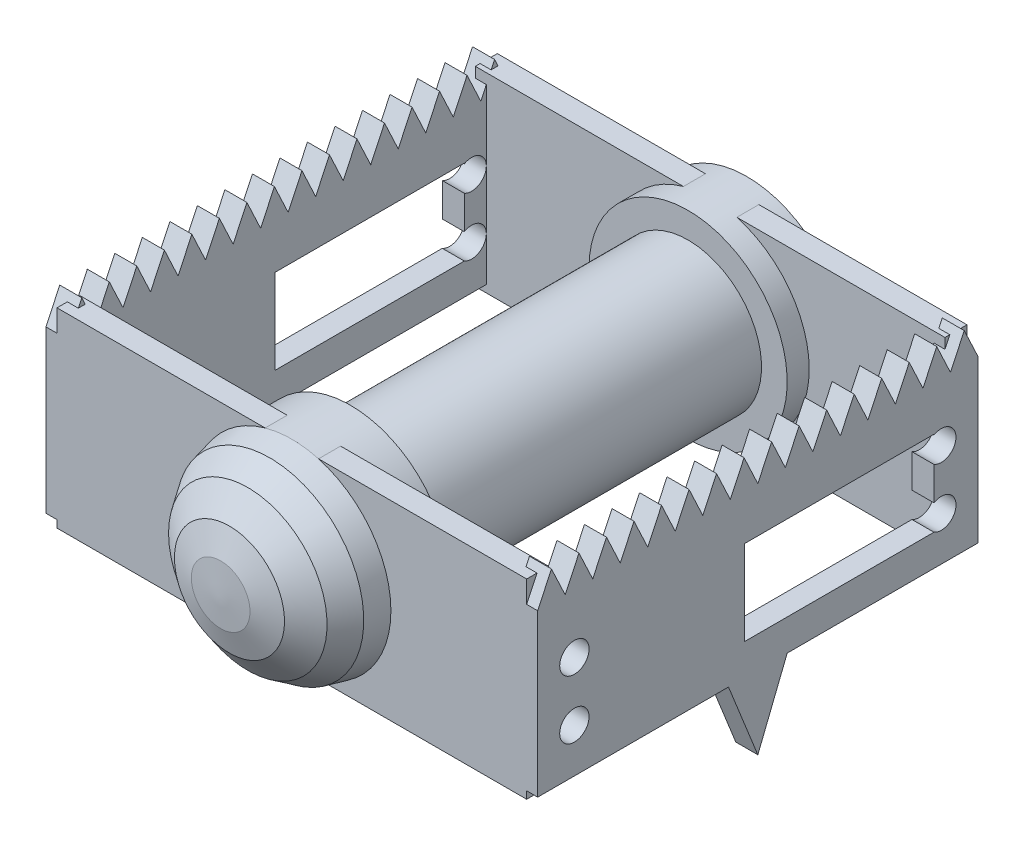
from build123d import *

# Parameters (mm, degrees)
PLACA_DELANTERA_START               = 203
PLACA_DELANTERA_DEPTH               = 3
AGUJERO_PLACA_DELANTERA_1_PROFILE_R = 2
AGUJERO_PLACA_DELANTERA_2_PROFILE_R = 2
AGUJERO_PLACA_DELANTERA_3_PROFILE_R = 2
AGUJERO_PLACA_DELANTERA_4_PROFILE_R = 2
PLACA_TRASERA_START                 = 139
PLACA_TRASERA_DEPTH                 = 3
AGUJERO_PLACA_TRASERA_1_PROFILE_R   = 2
AGUJERO_PLACA_TRASERA_2_PROFILE_R   = 2
AGUJERO_PLACA_TRASERA_3_PROFILE_R   = 2
AGUJERO_PLACA_TRASERA_4_PROFILE_R   = 2
MARCO_INTERIOR_START                = 86
SK_MARCO_INTERIOR_W                 = 64
SK_MARCO_INTERIOR_H                 = 26
SK_MARCO_INTERIOR_R                 = 11
MARCO_INTERIOR_DEPTH                = 3
MARCO_EXTERIOR_START                = 143
SK_MARCO_EXTERIOR_W                 = 64
SK_MARCO_EXTERIOR_H                 = 26
SK_MARCO_EXTERIOR_R                 = 11
MARCO_EXTERIOR_DEPTH                = 3
CROQUIS17_W                         = 25.795648089
CROQUIS17_H                         = 11.561302328
CORTAR_EXTRUIR1_DEPTH               = 10


with BuildPart() as part:
    # Sk_Eje_cuerpo → Eje_cuerpo (revolve)
    with BuildSketch(Plane(origin=(0, 0, 0), x_dir=(1, 0, 0), z_dir=(0, 1, 0))):
        Polygon((183.5, -84), (186, -84), (186, -92), (182.5, -92), (182.5, -138), (186, -138), (186, -146), (185.3, -149), (183.3, -152), (180, -154.5), (176.5, -155.7), (172.5, -156), (172.5, -147), (183.5, -147), (183.5, -138.5), (178.8, -138.5), (178.8, -91.5), (183.5, -91.5), align=None)
    revolve(axis=Axis((172.5, 0, 62.1), (0, 0, 1)))



with BuildPart() as body_2:
    # Sk_Placa_delantera → Placa_delantera (new body)
    with BuildSketch(Plane(origin=(0, 0, 0), x_dir=(0, 0, -1), z_dir=(1, 0, 0)).offset(PLACA_DELANTERA_START)):
        Polygon((-86, -12), (-112, -12), (-116, -22), (-120, -12), (-146, -12), (-146, 10), (-144.125, 14), (-142.25, 10), (-140.375, 14), (-138.5, 10), (-136.625, 14), (-134.75, 10), (-132.875, 14), (-131, 10), (-129.125, 14), (-127.25, 10), (-125.375, 14), (-123.5, 10), (-121.625, 14), (-119.75, 10), (-117.875, 14), (-116, 10), (-114.125, 14), (-112.25, 10), (-110.375, 14), (-108.5, 10), (-106.625, 14), (-104.75, 10), (-102.875, 14), (-101, 10), (-99.125, 14), (-97.25, 10), (-95.375, 14), (-93.5, 10), (-91.625, 14), (-89.75, 10), (-87.875, 14), (-86, 10), align=None)
    extrude(amount=PLACA_DELANTERA_DEPTH)

    # Agujero_Placa_delantera_1: sweep along a curve in space
    with BuildLine() as agujero_placa_delantera_1_path:
        Line((201.5, -6, 91), (207.5, -6, 91))
    # Agujero_Placa_delantera_1 profile (on start of the path) → Agujero_Placa_delantera_1 (sweep, cut)
    with BuildSketch(Plane(origin=(201.5, -6, 91), x_dir=(0, 0, 1), z_dir=(1, 0, 0))):
        Circle(AGUJERO_PLACA_DELANTERA_1_PROFILE_R)
    sweep(path=agujero_placa_delantera_1_path.line, mode=Mode.SUBTRACT)

    # Agujero_Placa_delantera_2: sweep along a curve in space
    with BuildLine() as agujero_placa_delantera_2_path:
        Line((201.5, 2, 91), (207.5, 2, 91))
    # Agujero_Placa_delantera_2 profile (on start of the path) → Agujero_Placa_delantera_2 (sweep, cut)
    with BuildSketch(Plane(origin=(201.5, 2, 91), x_dir=(0, 0, 1), z_dir=(1, 0, 0))):
        Circle(AGUJERO_PLACA_DELANTERA_2_PROFILE_R)
    sweep(path=agujero_placa_delantera_2_path.line, mode=Mode.SUBTRACT)

    # Agujero_Placa_delantera_3: sweep along a curve in space
    with BuildLine() as agujero_placa_delantera_3_path:
        Line((201.5, -6, 141), (207.5, -6, 141))
    # Agujero_Placa_delantera_3 profile (on start of the path) → Agujero_Placa_delantera_3 (sweep, cut)
    with BuildSketch(Plane(origin=(201.5, -6, 141), x_dir=(0, 0, 1), z_dir=(1, 0, 0))):
        Circle(AGUJERO_PLACA_DELANTERA_3_PROFILE_R)
    sweep(path=agujero_placa_delantera_3_path.line, mode=Mode.SUBTRACT)

    # Agujero_Placa_delantera_4: sweep along a curve in space
    with BuildLine() as agujero_placa_delantera_4_path:
        Line((201.5, 2, 141), (207.5, 2, 141))
    # Agujero_Placa_delantera_4 profile (on start of the path) → Agujero_Placa_delantera_4 (sweep, cut)
    with BuildSketch(Plane(origin=(201.5, 2, 141), x_dir=(0, 0, 1), z_dir=(1, 0, 0))):
        Circle(AGUJERO_PLACA_DELANTERA_4_PROFILE_R)
    sweep(path=agujero_placa_delantera_4_path.line, mode=Mode.SUBTRACT)


with BuildPart() as body_3:
    # Sk_Placa_trasera → Placa_trasera (new body)
    with BuildSketch(Plane(origin=(0, 0, 0), x_dir=(0, 0, -1), z_dir=(1, 0, 0)).offset(PLACA_TRASERA_START)):
        Polygon((-86, -12), (-146, -12), (-146, 10), (-144.125, 14), (-142.25, 10), (-140.375, 14), (-138.5, 10), (-136.625, 14), (-134.75, 10), (-132.875, 14), (-131, 10), (-129.125, 14), (-127.25, 10), (-125.375, 14), (-123.5, 10), (-121.625, 14), (-119.75, 10), (-117.875, 14), (-116, 10), (-114.125, 14), (-112.25, 10), (-110.375, 14), (-108.5, 10), (-106.625, 14), (-104.75, 10), (-102.875, 14), (-101, 10), (-99.125, 14), (-97.25, 10), (-95.375, 14), (-93.5, 10), (-91.625, 14), (-89.75, 10), (-87.875, 14), (-86, 10), align=None)
    extrude(amount=PLACA_TRASERA_DEPTH)

    # Agujero_Placa_trasera_1: sweep along a curve in space
    with BuildLine() as agujero_placa_trasera_1_path:
        Line((137.5, -6, 91), (143.5, -6, 91))
    # Agujero_Placa_trasera_1 profile (on start of the path) → Agujero_Placa_trasera_1 (sweep, cut)
    with BuildSketch(Plane(origin=(137.5, -6, 91), x_dir=(0, 0, 1), z_dir=(1, 0, 0))):
        Circle(AGUJERO_PLACA_TRASERA_1_PROFILE_R)
    sweep(path=agujero_placa_trasera_1_path.line, mode=Mode.SUBTRACT)

    # Agujero_Placa_trasera_2: sweep along a curve in space
    with BuildLine() as agujero_placa_trasera_2_path:
        Line((137.5, 2, 91), (143.5, 2, 91))
    # Agujero_Placa_trasera_2 profile (on start of the path) → Agujero_Placa_trasera_2 (sweep, cut)
    with BuildSketch(Plane(origin=(137.5, 2, 91), x_dir=(0, 0, 1), z_dir=(1, 0, 0))):
        Circle(AGUJERO_PLACA_TRASERA_2_PROFILE_R)
    sweep(path=agujero_placa_trasera_2_path.line, mode=Mode.SUBTRACT)

    # Agujero_Placa_trasera_3: sweep along a curve in space
    with BuildLine() as agujero_placa_trasera_3_path:
        Line((137.5, -6, 141), (143.5, -6, 141))
    # Agujero_Placa_trasera_3 profile (on start of the path) → Agujero_Placa_trasera_3 (sweep, cut)
    with BuildSketch(Plane(origin=(137.5, -6, 141), x_dir=(0, 0, 1), z_dir=(1, 0, 0))):
        Circle(AGUJERO_PLACA_TRASERA_3_PROFILE_R)
    sweep(path=agujero_placa_trasera_3_path.line, mode=Mode.SUBTRACT)

    # Agujero_Placa_trasera_4: sweep along a curve in space
    with BuildLine() as agujero_placa_trasera_4_path:
        Line((137.5, 2, 141), (143.5, 2, 141))
    # Agujero_Placa_trasera_4 profile (on start of the path) → Agujero_Placa_trasera_4 (sweep, cut)
    with BuildSketch(Plane(origin=(137.5, 2, 141), x_dir=(0, 0, 1), z_dir=(1, 0, 0))):
        Circle(AGUJERO_PLACA_TRASERA_4_PROFILE_R)
    sweep(path=agujero_placa_trasera_4_path.line, mode=Mode.SUBTRACT)


with BuildPart() as part_1:
    add(part.part)

    add(body_2.part)  # Marco_interior merges body 2

    add(body_3.part)  # Marco_interior merges body 3
    # Sk_Marco_interior → Marco_interior (add)
    with BuildSketch(Plane.XY.offset(MARCO_INTERIOR_START)):
        with Locations((172.5, 0)):
            Rectangle(SK_MARCO_INTERIOR_W, SK_MARCO_INTERIOR_H)
        with Locations((172.5, 0)):
            Circle(SK_MARCO_INTERIOR_R, mode=Mode.SUBTRACT)
    extrude(amount=MARCO_INTERIOR_DEPTH)

    # Sk_Marco_exterior → Marco_exterior (add)
    with BuildSketch(Plane.XY.offset(MARCO_EXTERIOR_START)):
        with Locations((172.5, 0)):
            Rectangle(SK_MARCO_EXTERIOR_W, SK_MARCO_EXTERIOR_H)
        with Locations((172.5, 0)):
            Circle(SK_MARCO_EXTERIOR_R, mode=Mode.SUBTRACT)
    extrude(amount=MARCO_EXTERIOR_DEPTH)

    # Croquis17 → Cortar-Extruir1 (cut)
    with BuildSketch(Plane(origin=(206, 0, 0), x_dir=(0, 0, -1), z_dir=(1, 0, 0))):
        with Locations((-104.897824044, -1.951399644)):
            Rectangle(CROQUIS17_W, CROQUIS17_H)
    cortar_extruir1 = extrude(amount=-CORTAR_EXTRUIR1_DEPTH, mode=Mode.SUBTRACT)

    # Simetría1: Cortar-Extruir1 across plane
    add(cortar_extruir1.mirror(Plane(origin=(172, 0, 0), x_dir=(0, 0, 1), z_dir=(1, 0, 0))), mode=Mode.SUBTRACT)


solid = part_1.part
